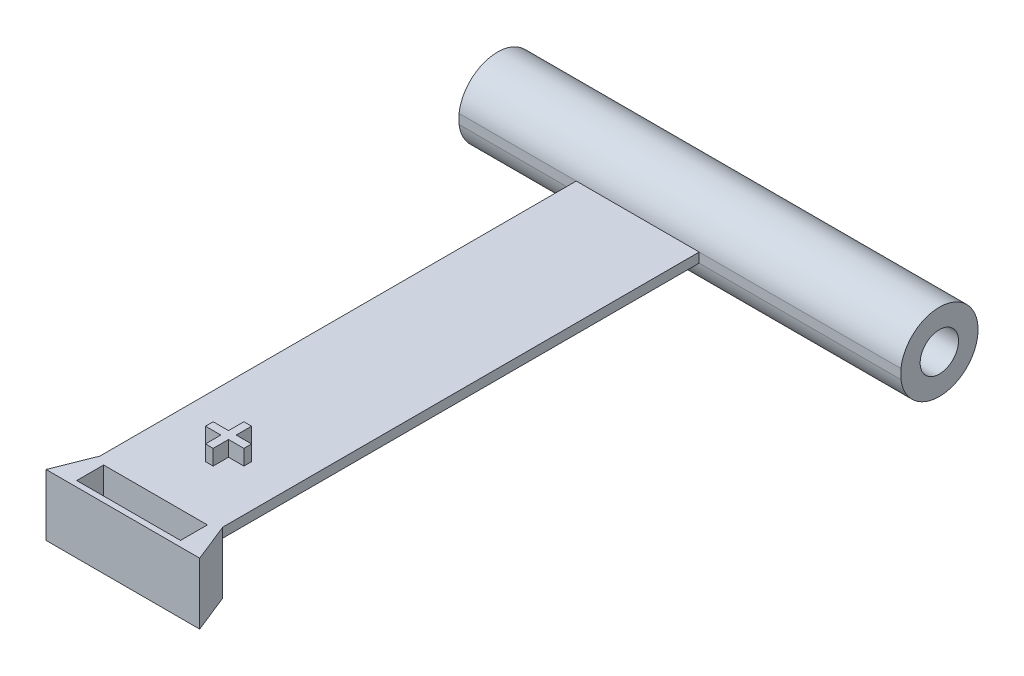
from build123d import *

# Parameters (mm, degrees)
BOSS_EXTRUDE2_DEPTH      = 32
SKETCH5_W                = 54
SKETCH5_H                = 14
CUT_EXTRUDE1_DEPTH       = 32
SKETCH6_W                = 64
SKETCH6_H                = 5
BOSS_EXTRUDE3_DEPTH      = 70
SKETCH7_W                = 2
SKETCH7_H                = 8
SKETCH7_H_2              = 2
SKETCH7_W_2              = 8
BOSS_EXTRUDE4_DEPTH      = 8
SKETCH8_W                = 64
SKETCH8_H                = 5
BOSS_EXTRUDE5_DEPTH      = 178
BOSS_EXTRUDE7_DEPTH      = 105
BOSS_EXTRUDE7_DEPTH_BACK = 125
CUT_EXTRUDE4_DEPTH       = 264


with BuildPart() as part:
    # Sketch4 → Boss-Extrude2 (new body)
    with BuildSketch(Plane(origin=(0, 0, 0), x_dir=(1, 0, 0), z_dir=(0, 1, 0))):
        Polygon((8, 20), (0, 0), (80, 0), (72, 20), align=None)
    extrude(amount=BOSS_EXTRUDE2_DEPTH)

    # Sketch5 → Cut-Extrude1 (cut)
    with BuildSketch(Plane(origin=(0, 32, 0), x_dir=(1, 0, 0), z_dir=(0, 1, 0))):
        with Locations((40, 10)):
            Rectangle(SKETCH5_W, SKETCH5_H)
    extrude(amount=-CUT_EXTRUDE1_DEPTH, mode=Mode.SUBTRACT)

    # Sketch6 → Boss-Extrude3 (add)
    with BuildSketch(Plane(origin=(0, 0, -20), x_dir=(-1, 0, 0), z_dir=(0, 0, -1))):
        with Locations((-40, 29.5)):
            Rectangle(SKETCH6_W, SKETCH6_H)
    extrude(amount=BOSS_EXTRUDE3_DEPTH)

    # Sketch7 → Boss-Extrude4 (add)
    with BuildSketch(Plane(origin=(0, 32, 0), x_dir=(1, 0, 0), z_dir=(0, 1, 0))):
        with Locations((41, 61)):
            Rectangle(SKETCH7_W, SKETCH7_H)
        with Locations((39, 61)):
            Rectangle(SKETCH7_W, SKETCH7_H)
        with Locations((39, 56)):
            Rectangle(SKETCH7_W, SKETCH7_H_2)
        with Locations((41, 56)):
            Rectangle(SKETCH7_W, SKETCH7_H_2)
        with Locations((34, 56)):
            Rectangle(SKETCH7_W_2, SKETCH7_H_2)
        with Locations((34, 54)):
            Rectangle(SKETCH7_W_2, SKETCH7_H_2)
        with Locations((39, 54)):
            Rectangle(SKETCH7_W, SKETCH7_H_2)
        with Locations((41, 54)):
            Rectangle(SKETCH7_W, SKETCH7_H_2)
        with Locations((41, 49)):
            Rectangle(SKETCH7_W, SKETCH7_H)
        with Locations((39, 49)):
            Rectangle(SKETCH7_W, SKETCH7_H)
        with Locations((46, 54)):
            Rectangle(SKETCH7_W_2, SKETCH7_H_2)
        with Locations((46, 56)):
            Rectangle(SKETCH7_W_2, SKETCH7_H_2)
    extrude(amount=BOSS_EXTRUDE4_DEPTH)

    # Sketch8 → Boss-Extrude5 (add)
    with BuildSketch(Plane(origin=(0, 0, -90), x_dir=(-1, 0, 0), z_dir=(0, 0, -1))):
        with Locations((-40, 29.5)):
            Rectangle(SKETCH8_W, SKETCH8_H)
    extrude(amount=BOSS_EXTRUDE5_DEPTH)

    # Sketch13 → Boss-Extrude7 (add, two sides: drawn at the far end of the back side and taken through both)
    with BuildSketch(Plane(origin=(72, 0, 0), x_dir=(0, 0, -1), z_dir=(1, 0, 0)).offset(-BOSS_EXTRUDE7_DEPTH_BACK)):
        with BuildLine():
            ThreePointArc((268, 27), (289.252420174, 9.383304354), (308.155644371, 29.5))
            ThreePointArc((308.155644371, 29.5), (289.252420174, 49.616695646), (268, 32))
            Line((268, 32), (268, 29.5))
            Line((268, 29.5), (268, 27))
        make_face()
    extrude(amount=BOSS_EXTRUDE7_DEPTH + BOSS_EXTRUDE7_DEPTH_BACK)

    # Sketch14 → Cut-Extrude4 (cut)
    with BuildSketch(Plane(origin=(177, 0, 0), x_dir=(0, 0, -1), z_dir=(1, 0, 0))):
        with BuildLine():
            ThreePointArc((298, 29.5), (295.071067812, 36.571067812), (288, 39.5))
            Line((288, 39.5), (288, 19.5))
            ThreePointArc((288, 19.5), (295.071067812, 22.428932188), (298, 29.5))
        make_face()
        with BuildLine():
            Line((288, 19.5), (288, 39.5))
            ThreePointArc((288, 39.5), (278, 29.5), (288, 19.5))
        make_face()
    extrude(amount=-CUT_EXTRUDE4_DEPTH, mode=Mode.SUBTRACT)


solid = part.part
